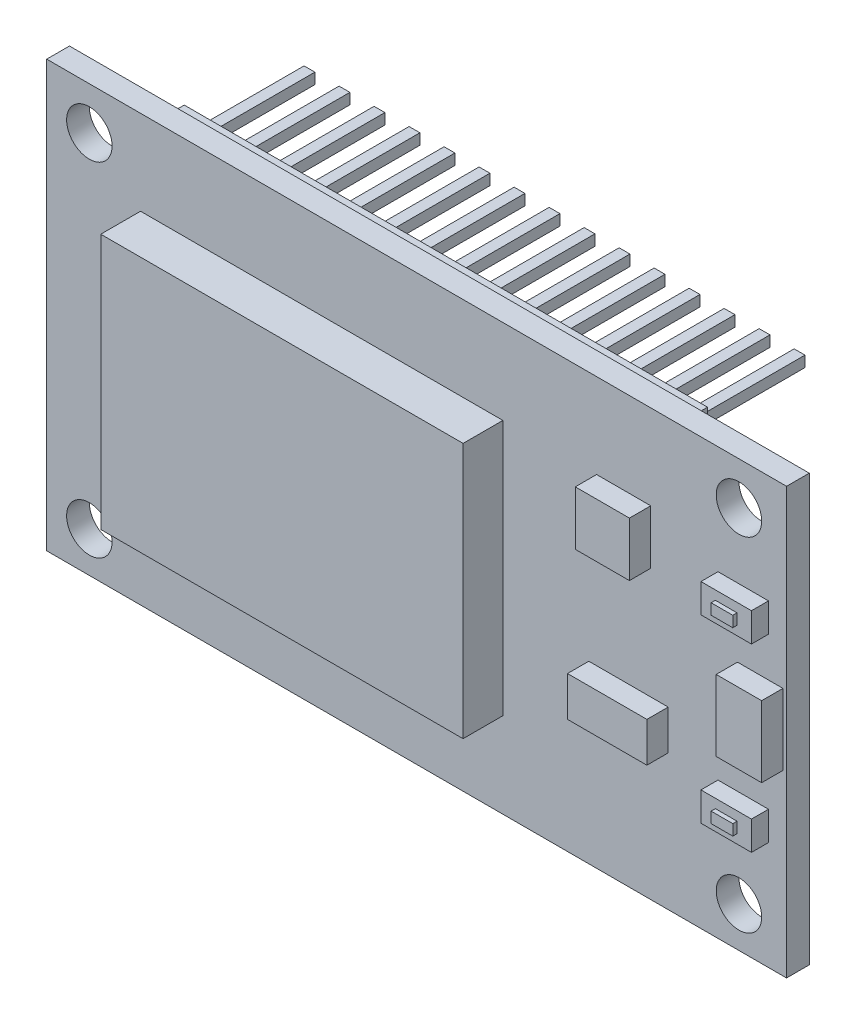
from build123d import *

# Parameters (mm, degrees)
SKETCH1_W                  = 52.07
SKETCH1_H                  = 29.972
BOSS_EXTRUDE1_DEPTH        = 1.6
SKETCH2_R                  = 1.6
CUT_EXTRUDE1_DEPTH         = 1.6
LPATTERN1_COUNT            = 2
LPATTERN1_PITCH            = 45.72
LPATTERN2_COUNT            = 2
LPATTERN2_PITCH            = 24.13
LPATTERN2_COPY_1_SKETCH_R  = 1.6
LPATTERN2_COPY_1_DEPTH     = 1.6
SKETCH3_W                  = 36.83
SKETCH3_H                  = 2.794
BOSS_EXTRUDE2_DEPTH        = 2.032
SKETCH4_W                  = 0.762
SKETCH4_H                  = 0.762
BOSS_EXTRUDE3_DEPTH        = 7.62
LPATTERN3_COUNT            = 15
LPATTERN3_PITCH            = 2.4638
LPATTERN4_COUNT            = 2
LPATTERN4_PITCH            = 24.13
LPATTERN4_COPY_1_SKETCH_W  = 0.762
LPATTERN4_COPY_1_SKETCH_H  = 0.762
LPATTERN4_COPY_1_DEPTH     = 7.62
LPATTERN4_COPY_2_SKETCH_W  = 0.762
LPATTERN4_COPY_2_SKETCH_H  = 0.762
LPATTERN4_COPY_2_DEPTH     = 7.62
LPATTERN4_COPY_3_SKETCH_W  = 0.762
LPATTERN4_COPY_3_SKETCH_H  = 0.762
LPATTERN4_COPY_3_DEPTH     = 7.62
LPATTERN4_COPY_4_SKETCH_W  = 0.762
LPATTERN4_COPY_4_SKETCH_H  = 0.762
LPATTERN4_COPY_4_DEPTH     = 7.62
LPATTERN4_COPY_5_SKETCH_W  = 0.762
LPATTERN4_COPY_5_SKETCH_H  = 0.762
LPATTERN4_COPY_5_DEPTH     = 7.62
LPATTERN4_COPY_6_SKETCH_W  = 0.762
LPATTERN4_COPY_6_SKETCH_H  = 0.762
LPATTERN4_COPY_6_DEPTH     = 7.62
LPATTERN4_COPY_7_SKETCH_W  = 0.762
LPATTERN4_COPY_7_SKETCH_H  = 0.762
LPATTERN4_COPY_7_DEPTH     = 7.62
LPATTERN4_COPY_8_SKETCH_W  = 0.762
LPATTERN4_COPY_8_SKETCH_H  = 0.762
LPATTERN4_COPY_8_DEPTH     = 7.62
LPATTERN4_COPY_9_SKETCH_W  = 0.762
LPATTERN4_COPY_9_SKETCH_H  = 0.762
LPATTERN4_COPY_9_DEPTH     = 7.62
LPATTERN4_COPY_10_SKETCH_W = 0.762
LPATTERN4_COPY_10_SKETCH_H = 0.762
LPATTERN4_COPY_10_DEPTH    = 7.62
LPATTERN4_COPY_11_SKETCH_W = 0.762
LPATTERN4_COPY_11_SKETCH_H = 0.762
LPATTERN4_COPY_11_DEPTH    = 7.62
LPATTERN4_COPY_12_SKETCH_W = 0.762
LPATTERN4_COPY_12_SKETCH_H = 0.762
LPATTERN4_COPY_12_DEPTH    = 7.62
LPATTERN4_COPY_13_SKETCH_W = 0.762
LPATTERN4_COPY_13_SKETCH_H = 0.762
LPATTERN4_COPY_13_DEPTH    = 7.62
LPATTERN4_COPY_14_SKETCH_W = 0.762
LPATTERN4_COPY_14_SKETCH_H = 0.762
LPATTERN4_COPY_14_DEPTH    = 7.62
SKETCH5_W                  = 25.500000054
SKETCH5_H                  = 18.000000068
BOSS_EXTRUDE4_DEPTH        = 2.8
SKETCH7_W                  = 3.19999995
SKETCH7_H                  = 4.999999906
BOSS_EXTRUDE5_DEPTH        = 1.5
SKETCH8_W                  = 3.556
SKETCH8_H                  = 2.032
BOSS_EXTRUDE6_DEPTH        = 1.2
SKETCH9_W                  = 1.524
SKETCH9_H                  = 0.762
BOSS_EXTRUDE7_DEPTH        = 0.3
LPATTERN5_COUNT            = 2
LPATTERN5_PITCH            = 12.7
SKETCH10_W                 = 3.81
SKETCH10_H                 = 3.81
BOSS_EXTRUDE8_DEPTH        = 1.5
SKETCH11_W                 = 5.588
SKETCH11_H                 = 2.794
BOSS_EXTRUDE9_DEPTH        = 1.5


with BuildPart() as part:
    # Sketch1 → Boss-Extrude1 (new body)
    with BuildSketch(Plane.XY):
        with Locations((26.035, 14.986)):
            Rectangle(SKETCH1_W, SKETCH1_H)
    extrude(amount=BOSS_EXTRUDE1_DEPTH)

    # Sketch2 → Cut-Extrude1 (cut)
    with BuildSketch(Plane.XY):
        with Locations((3, 26.972)):
            Circle(SKETCH2_R)
    cut_extrude1 = extrude(amount=CUT_EXTRUDE1_DEPTH, mode=Mode.SUBTRACT)

    # LPattern1: Cut-Extrude1 ×2
    with Locations(*[(i * LPATTERN1_PITCH, 0, 0) for i in range(1, LPATTERN1_COUNT)]):
        add(cut_extrude1, mode=Mode.SUBTRACT)

    # LPattern2: Cut-Extrude1 ×2
    with Locations(*[(0, -i * LPATTERN2_PITCH, 0) for i in range(1, LPATTERN2_COUNT)]):
        add(cut_extrude1, mode=Mode.SUBTRACT)

    # LPattern2 copy 1 sketch → LPattern2 copy 1 (cut)
    with BuildSketch(Plane(origin=(45.72, -24.13, 0), x_dir=(1, 0, 0), z_dir=(0, 0, 1))):
        with Locations((3, 26.972)):
            Circle(LPATTERN2_COPY_1_SKETCH_R)
    extrude(amount=LPATTERN2_COPY_1_DEPTH, mode=Mode.SUBTRACT)

    # Sketch3 → Boss-Extrude2 (add)
    with BuildSketch(Plane(origin=(0, 0, 0), x_dir=(-1, 0, 0), z_dir=(0, 0, -1))):
        with Locations((-24.463, 26.983689689)):
            Rectangle(SKETCH3_W, SKETCH3_H)
    boss_extrude2 = extrude(amount=BOSS_EXTRUDE2_DEPTH)

    # Sketch4 → Boss-Extrude3 (add)
    with BuildSketch(Plane(origin=(0, 0, -2.032), x_dir=(-1, 0, 0), z_dir=(0, 0, -1))):
        with Locations((-41.735, 26.983689689)):
            Rectangle(SKETCH4_W, SKETCH4_H)
    boss_extrude3 = extrude(amount=BOSS_EXTRUDE3_DEPTH)

    # LPattern3: Boss-Extrude3 ×15
    with Locations(*[(-i * LPATTERN3_PITCH, 0, 0) for i in range(1, LPATTERN3_COUNT)]):
        add(boss_extrude3)

    # LPattern4: Boss-Extrude2, Boss-Extrude3 ×2
    with Locations(*[(0, -i * LPATTERN4_PITCH, 0) for i in range(1, LPATTERN4_COUNT)]):
        add(boss_extrude2)
        add(boss_extrude3)

    # LPattern4 copy 1 sketch → LPattern4 copy 1 (add)
    with BuildSketch(Plane(origin=(-2.4638, -24.13, -2.032), x_dir=(-1, 0, 0), z_dir=(0, 0, -1))):
        with Locations((-41.735, 26.983689689)):
            Rectangle(LPATTERN4_COPY_1_SKETCH_W, LPATTERN4_COPY_1_SKETCH_H)
    extrude(amount=LPATTERN4_COPY_1_DEPTH)

    # LPattern4 copy 2 sketch → LPattern4 copy 2 (add)
    with BuildSketch(Plane(origin=(-4.9276, -24.13, -2.032), x_dir=(-1, 0, 0), z_dir=(0, 0, -1))):
        with Locations((-41.735, 26.983689689)):
            Rectangle(LPATTERN4_COPY_2_SKETCH_W, LPATTERN4_COPY_2_SKETCH_H)
    extrude(amount=LPATTERN4_COPY_2_DEPTH)

    # LPattern4 copy 3 sketch → LPattern4 copy 3 (add)
    with BuildSketch(Plane(origin=(-7.3914, -24.13, -2.032), x_dir=(-1, 0, 0), z_dir=(0, 0, -1))):
        with Locations((-41.735, 26.983689689)):
            Rectangle(LPATTERN4_COPY_3_SKETCH_W, LPATTERN4_COPY_3_SKETCH_H)
    extrude(amount=LPATTERN4_COPY_3_DEPTH)

    # LPattern4 copy 4 sketch → LPattern4 copy 4 (add)
    with BuildSketch(Plane(origin=(-9.8552, -24.13, -2.032), x_dir=(-1, 0, 0), z_dir=(0, 0, -1))):
        with Locations((-41.735, 26.983689689)):
            Rectangle(LPATTERN4_COPY_4_SKETCH_W, LPATTERN4_COPY_4_SKETCH_H)
    extrude(amount=LPATTERN4_COPY_4_DEPTH)

    # LPattern4 copy 5 sketch → LPattern4 copy 5 (add)
    with BuildSketch(Plane(origin=(-12.319, -24.13, -2.032), x_dir=(-1, 0, 0), z_dir=(0, 0, -1))):
        with Locations((-41.735, 26.983689689)):
            Rectangle(LPATTERN4_COPY_5_SKETCH_W, LPATTERN4_COPY_5_SKETCH_H)
    extrude(amount=LPATTERN4_COPY_5_DEPTH)

    # LPattern4 copy 6 sketch → LPattern4 copy 6 (add)
    with BuildSketch(Plane(origin=(-14.7828, -24.13, -2.032), x_dir=(-1, 0, 0), z_dir=(0, 0, -1))):
        with Locations((-41.735, 26.983689689)):
            Rectangle(LPATTERN4_COPY_6_SKETCH_W, LPATTERN4_COPY_6_SKETCH_H)
    extrude(amount=LPATTERN4_COPY_6_DEPTH)

    # LPattern4 copy 7 sketch → LPattern4 copy 7 (add)
    with BuildSketch(Plane(origin=(-17.2466, -24.13, -2.032), x_dir=(-1, 0, 0), z_dir=(0, 0, -1))):
        with Locations((-41.735, 26.983689689)):
            Rectangle(LPATTERN4_COPY_7_SKETCH_W, LPATTERN4_COPY_7_SKETCH_H)
    extrude(amount=LPATTERN4_COPY_7_DEPTH)

    # LPattern4 copy 8 sketch → LPattern4 copy 8 (add)
    with BuildSketch(Plane(origin=(-19.7104, -24.13, -2.032), x_dir=(-1, 0, 0), z_dir=(0, 0, -1))):
        with Locations((-41.735, 26.983689689)):
            Rectangle(LPATTERN4_COPY_8_SKETCH_W, LPATTERN4_COPY_8_SKETCH_H)
    extrude(amount=LPATTERN4_COPY_8_DEPTH)

    # LPattern4 copy 9 sketch → LPattern4 copy 9 (add)
    with BuildSketch(Plane(origin=(-22.1742, -24.13, -2.032), x_dir=(-1, 0, 0), z_dir=(0, 0, -1))):
        with Locations((-41.735, 26.983689689)):
            Rectangle(LPATTERN4_COPY_9_SKETCH_W, LPATTERN4_COPY_9_SKETCH_H)
    extrude(amount=LPATTERN4_COPY_9_DEPTH)

    # LPattern4 copy 10 sketch → LPattern4 copy 10 (add)
    with BuildSketch(Plane(origin=(-24.638, -24.13, -2.032), x_dir=(-1, 0, 0), z_dir=(0, 0, -1))):
        with Locations((-41.735, 26.983689689)):
            Rectangle(LPATTERN4_COPY_10_SKETCH_W, LPATTERN4_COPY_10_SKETCH_H)
    extrude(amount=LPATTERN4_COPY_10_DEPTH)

    # LPattern4 copy 11 sketch → LPattern4 copy 11 (add)
    with BuildSketch(Plane(origin=(-27.1018, -24.13, -2.032), x_dir=(-1, 0, 0), z_dir=(0, 0, -1))):
        with Locations((-41.735, 26.983689689)):
            Rectangle(LPATTERN4_COPY_11_SKETCH_W, LPATTERN4_COPY_11_SKETCH_H)
    extrude(amount=LPATTERN4_COPY_11_DEPTH)

    # LPattern4 copy 12 sketch → LPattern4 copy 12 (add)
    with BuildSketch(Plane(origin=(-29.5656, -24.13, -2.032), x_dir=(-1, 0, 0), z_dir=(0, 0, -1))):
        with Locations((-41.735, 26.983689689)):
            Rectangle(LPATTERN4_COPY_12_SKETCH_W, LPATTERN4_COPY_12_SKETCH_H)
    extrude(amount=LPATTERN4_COPY_12_DEPTH)

    # LPattern4 copy 13 sketch → LPattern4 copy 13 (add)
    with BuildSketch(Plane(origin=(-32.0294, -24.13, -2.032), x_dir=(-1, 0, 0), z_dir=(0, 0, -1))):
        with Locations((-41.735, 26.983689689)):
            Rectangle(LPATTERN4_COPY_13_SKETCH_W, LPATTERN4_COPY_13_SKETCH_H)
    extrude(amount=LPATTERN4_COPY_13_DEPTH)

    # LPattern4 copy 14 sketch → LPattern4 copy 14 (add)
    with BuildSketch(Plane(origin=(-34.4932, -24.13, -2.032), x_dir=(-1, 0, 0), z_dir=(0, 0, -1))):
        with Locations((-41.735, 26.983689689)):
            Rectangle(LPATTERN4_COPY_14_SKETCH_W, LPATTERN4_COPY_14_SKETCH_H)
    extrude(amount=LPATTERN4_COPY_14_DEPTH)

    # Sketch5 → Boss-Extrude4 (add)
    with BuildSketch(Plane.XY.offset(1.6)):
        with Locations((19.354000027, 15.002999966)):
            Rectangle(SKETCH5_W, SKETCH5_H)
    extrude(amount=BOSS_EXTRUDE4_DEPTH)

    # Sketch7 → Boss-Extrude5 (add)
    with BuildSketch(Plane.XY.offset(1.6)):
        with Locations((50.216000025, 15.026000047)):
            Rectangle(SKETCH7_W, SKETCH7_H)
    extrude(amount=BOSS_EXTRUDE5_DEPTH)

    # Sketch8 → Boss-Extrude6 (add)
    with BuildSketch(Plane.XY.offset(1.6)):
        with Locations((49.022, 21.336)):
            Rectangle(SKETCH8_W, SKETCH8_H)
    boss_extrude6 = extrude(amount=BOSS_EXTRUDE6_DEPTH)

    # Sketch9 → Boss-Extrude7 (add)
    with BuildSketch(Plane.XY.offset(2.8)):
        with Locations((49.022, 21.336)):
            Rectangle(SKETCH9_W, SKETCH9_H)
    boss_extrude7 = extrude(amount=BOSS_EXTRUDE7_DEPTH)

    # LPattern5: Boss-Extrude6, Boss-Extrude7 ×2
    with Locations(*[(0, -i * LPATTERN5_PITCH, 0) for i in range(1, LPATTERN5_COUNT)]):
        add(boss_extrude6)
        add(boss_extrude7)

    # Sketch10 → Boss-Extrude8 (add)
    with BuildSketch(Plane.XY.offset(1.6)):
        with Locations((40.606067354, 22.098)):
            Rectangle(SKETCH10_W, SKETCH10_H)
    extrude(amount=BOSS_EXTRUDE8_DEPTH)

    # Sketch11 → Boss-Extrude9 (add)
    with BuildSketch(Plane.XY.offset(1.6)):
        with Locations((40.946708752, 10.9524599)):
            Rectangle(SKETCH11_W, SKETCH11_H)
    extrude(amount=BOSS_EXTRUDE9_DEPTH)


solid = part.part
